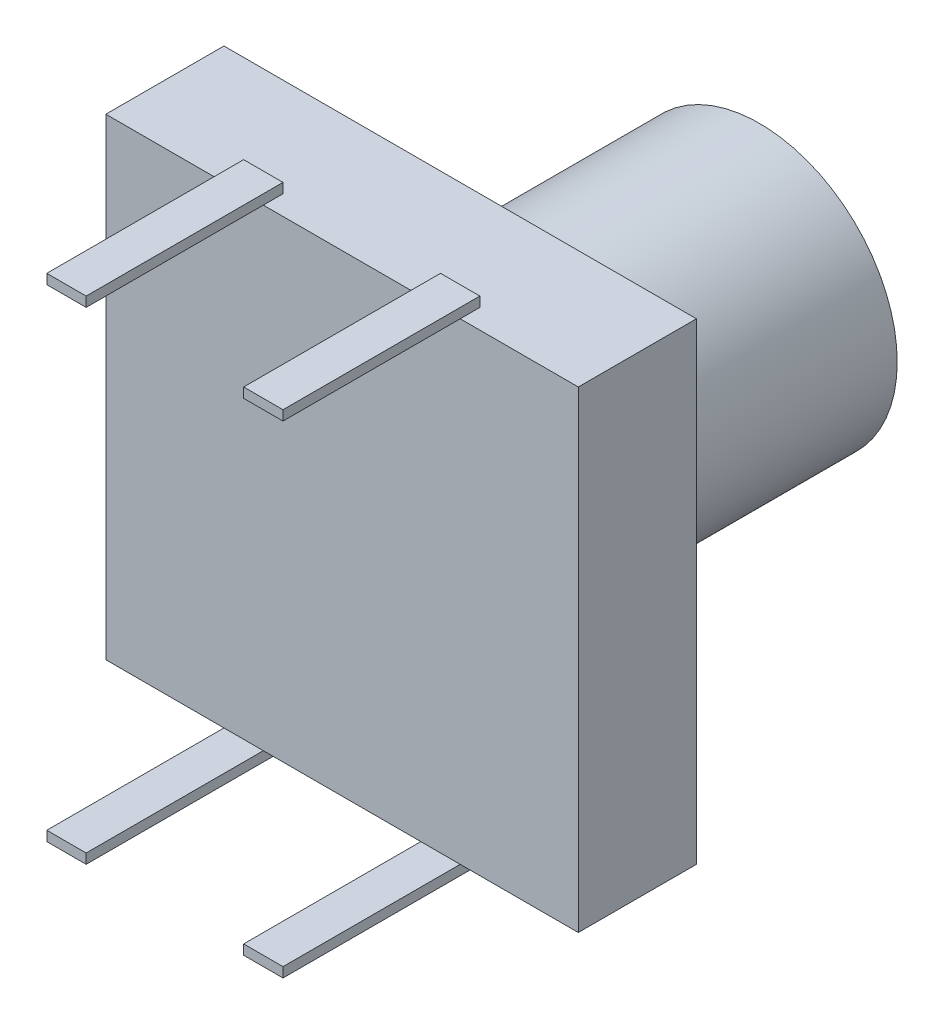
from build123d import *

# Parameters (mm, degrees)
SKETCH1_W               = 12
SKETCH1_H               = 12
BOSS_EXTRUDE1_DEPTH     = 3
SKETCH4_W               = 10
SKETCH4_H               = 10
BOSS_EXTRUDE2_DEPTH     = 0.1
SKETCH5_R               = 0.5
BOSS_EXTRUDE3_DEPTH     = 0.25
SKETCH7_R               = 0.5
BOSS_EXTRUDE4_DEPTH     = 0.25
SKETCH9_R               = 3.5
BOSS_EXTRUDE5_DEPTH     = 7.5
SKETCH10_W              = 1
SKETCH10_H              = 5
BOSS_EXTRUDE6_DEPTH     = 0.25
MIRROR3_COPY_1_SKETCH_W = 1
MIRROR3_COPY_1_SKETCH_H = 5
MIRROR3_COPY_1_DEPTH    = 0.25


with BuildPart() as part:
    # Sketch1 → Boss-Extrude1 (new body)
    with BuildSketch(Plane.XY):
        Rectangle(SKETCH1_W, SKETCH1_H)
    extrude(amount=BOSS_EXTRUDE1_DEPTH)

    # Sketch4 → Boss-Extrude2 (add)
    with BuildSketch(Plane(origin=(0, 0, 0), x_dir=(-1, 0, 0), z_dir=(0, 0, -1))):
        Rectangle(SKETCH4_W, SKETCH4_H)
    extrude(amount=BOSS_EXTRUDE2_DEPTH)

    # Sketch5 → Boss-Extrude3 (add)
    with BuildSketch(Plane(origin=(0, 0, -0.1), x_dir=(-1, 0, 0), z_dir=(0, 0, -1))):
        with Locations((4.314401818, 4.299659248)):
            Circle(SKETCH5_R)
    boss_extrude3 = extrude(amount=BOSS_EXTRUDE3_DEPTH)

    # Sketch7 → Boss-Extrude4 (add)
    with BuildSketch(Plane(origin=(-0.182739642, -0.928429526, -0.1), x_dir=(-1, 0, 0), z_dir=(0, 0, -1))):
        with Locations((4.084292385, -3.383848304)):
            Circle(SKETCH7_R)
    boss_extrude4 = extrude(amount=BOSS_EXTRUDE4_DEPTH)

    # Mirror1: Boss-Extrude3, Boss-Extrude4 across plane
    add(boss_extrude3.mirror(Plane(origin=(0, 0, 0), x_dir=(0, 0, 1), z_dir=(1, 0, 0))))
    add(boss_extrude4.mirror(Plane(origin=(0, 0, 0), x_dir=(0, 0, 1), z_dir=(1, 0, 0))))

    # Sketch9 → Boss-Extrude5 (add)
    with BuildSketch(Plane(origin=(0, 0, -0.1), x_dir=(-1, 0, 0), z_dir=(0, 0, -1))):
        Circle(SKETCH9_R)
    extrude(amount=BOSS_EXTRUDE5_DEPTH)

    # Sketch10 → Boss-Extrude6 (add)
    with BuildSketch(Plane.XZ.offset(6)):
        with Locations((2.5, 5)):
            Rectangle(SKETCH10_W, SKETCH10_H)
    boss_extrude6 = extrude(amount=BOSS_EXTRUDE6_DEPTH)

    # Mirror2: Boss-Extrude6 across plane
    add(boss_extrude6.mirror(Plane(origin=(0, 0, 0), x_dir=(0, 0, 1), z_dir=(1, 0, 0))))

    # Mirror3: Boss-Extrude6 across plane
    add(boss_extrude6.mirror(Plane.ZX))

    # Mirror3 copy 1 sketch → Mirror3 copy 1 (add)
    with BuildSketch(Plane(origin=(0, 6, 0), x_dir=(-1, 0, 0), z_dir=(0, 1, 0))):
        with Locations((2.5, 5)):
            Rectangle(MIRROR3_COPY_1_SKETCH_W, MIRROR3_COPY_1_SKETCH_H)
    extrude(amount=MIRROR3_COPY_1_DEPTH)


solid = part.part
